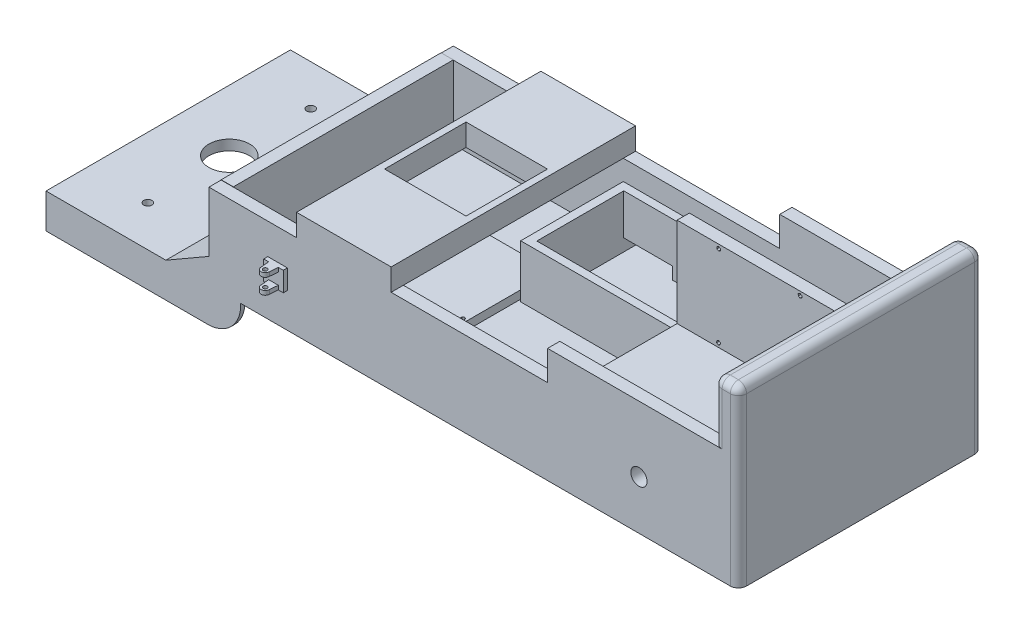
from build123d import *

# Parameters (mm, degrees)
SKETCH1_W            = 650
SKETCH1_H            = 300
BOSS_EXTRUDE1_DEPTH  = 14.434231023
SKETCH2_W            = 30
SKETCH2_H            = 300
BOSS_EXTRUDE2_DEPTH  = 200
SKETCH3_W            = 204.257885315
SKETCH3_H            = 126.141731803
BOSS_EXTRUDE3_DEPTH  = 15
SKETCH4_W            = 204.257885315
SKETCH4_H            = 126.141731803
BOSS_EXTRUDE4_DEPTH  = 15
SKETCH5_R            = 10
CUT_EXTRUDE1_DEPTH   = 330
SKETCH7_W            = 415.742114685
SKETCH7_H            = 89.704743667
BOSS_EXTRUDE5_DEPTH  = 15
SKETCH8_W            = 415.742114685
SKETCH8_H            = 89.704743667
BOSS_EXTRUDE7_DEPTH  = 15
SKETCH9_R            = 10
CUT_EXTRUDE2_DEPTH   = 484
SKETCH14_W           = 204.257885315
SKETCH14_H           = 15
BOSS_EXTRUDE8_DEPTH  = 144
SKETCH19_W           = 204.257885315
SKETCH19_H           = 15
BOSS_EXTRUDE11_DEPTH = 15
SKETCH22_W           = 204.257885315
SKETCH22_H           = 15
BOSS_EXTRUDE13_DEPTH = 110
CUT_EXTRUDE6_DEPTH   = 23
SKETCH24_W           = 300
SKETCH24_H           = 42.5
BOSS_EXTRUDE14_DEPTH = 200
BOSS_EXTRUDE16_DEPTH = 300
SKETCH25_W           = 290
SKETCH25_H           = 29.941232447
CUT_EXTRUDE9_DEPTH   = 287
BOSS_EXTRUDE17_DEPTH = 5
BOSS_EXTRUDE18_START = -5
BOSS_EXTRUDE18_DEPTH = 5
SKETCH17_W           = 147.149375164
SKETCH17_H           = 19.732989455
CUT_EXTRUDE10_DEPTH  = 40
SKETCH40_W           = 204.257885315
SKETCH40_H           = 12.033278305
BOSS_EXTRUDE19_DEPTH = 116
SKETCH42_W           = 120
SKETCH42_H           = 95
BOSS_EXTRUDE21_DEPTH = 8
SKETCH45_W           = 113
SKETCH45_H           = 89
CUT_EXTRUDE14_DEPTH  = 6
SKETCH46_W           = 110
SKETCH46_H           = 110
BOSS_EXTRUDE22_DEPTH = 10
CUT_EXTRUDE18_DEPTH  = 14.5
SKETCH39_R           = 25
SKETCH39_R_2         = 5
CUT_EXTRUDE19_DEPTH  = 42
SKETCH50_W           = 15
SKETCH50_H           = 270
BOSS_EXTRUDE30_DEPTH = 90
SKETCH51_W           = 116.188567321
SKETCH51_H           = 300
BOSS_EXTRUDE33_DEPTH = 27
SKETCH56_W           = 100
SKETCH56_H           = 100
CUT_EXTRUDE22_DEPTH  = 46
SKETCH58_W           = 24
SKETCH58_H           = 24
BOSS_EXTRUDE35_DEPTH = 5
SKETCH61_W           = 24
SKETCH61_H           = 24
BOSS_EXTRUDE36_DEPTH = 5
BOSS_EXTRUDE37_DEPTH = 5
BOSS_EXTRUDE38_START = -5
BOSS_EXTRUDE38_DEPTH = 5
SKETCH64_R           = 2.55
CUT_EXTRUDE23_DEPTH  = 93
BOSS_EXTRUDE39_DEPTH = 5
BOSS_EXTRUDE41_START = -5
BOSS_EXTRUDE41_DEPTH = 5
SKETCH68_R           = 2.536334828
CUT_EXTRUDE25_DEPTH  = 77
SKETCH69_W           = 192.024478138
SKETCH69_H           = 126
BOSS_EXTRUDE42_DEPTH = 65
SKETCH70_W           = 172.724880691
SKETCH70_H           = 106.7
CUT_EXTRUDE26_DEPTH  = 65
FILLET1_R            = 10
FILLET2_R            = 10
FILLET3_R            = 10
FILLET4_R            = 10
SKETCH72_W           = 60
SKETCH72_H           = 15
CUT_EXTRUDE30_DEPTH  = 29


with BuildPart() as part:
    # Sketch1 → Boss-Extrude1 (new body)
    with BuildSketch(Plane(origin=(0, 0, 0), x_dir=(1, 0, 0), z_dir=(0, 1, 0))):
        with Locations((73.326959847, 18.881453155)):
            Rectangle(SKETCH1_W, SKETCH1_H)
    extrude(amount=BOSS_EXTRUDE1_DEPTH)

    # Sketch2 → Boss-Extrude2 (add)
    with BuildSketch(Plane(origin=(0, 14.434231023, 0), x_dir=(1, 0, 0), z_dir=(0, 1, 0))):
        with Locations((383.326959847, 18.881453155)):
            Rectangle(SKETCH2_W, SKETCH2_H)
    extrude(amount=BOSS_EXTRUDE2_DEPTH)

    # Sketch3 → Boss-Extrude3 (add)
    with BuildSketch(Plane.XY.offset(131.118546845)):
        with Locations((266.198017189, 77.505096925)):
            Rectangle(SKETCH3_W, SKETCH3_H)
    extrude(amount=-BOSS_EXTRUDE3_DEPTH)

    # Sketch4 → Boss-Extrude4 (add)
    with BuildSketch(Plane(origin=(0, 0, -168.881453155), x_dir=(-1, 0, 0), z_dir=(0, 0, -1))):
        with Locations((-266.198017189, 77.505096925)):
            Rectangle(SKETCH4_W, SKETCH4_H)
    extrude(amount=-BOSS_EXTRUDE4_DEPTH)

    # Sketch5 → Cut-Extrude1 (cut)
    with BuildSketch(Plane.XY.offset(131.118546845)):
        with Locations((276.18288418, 59.994162141)):
            Circle(SKETCH5_R)
    extrude(amount=-CUT_EXTRUDE1_DEPTH, mode=Mode.SUBTRACT)

    # Sketch7 → Boss-Extrude5 (add)
    with BuildSketch(Plane.XY.offset(131.118546845)):
        with Locations((-43.801982811, 59.286602857)):
            Rectangle(SKETCH7_W, SKETCH7_H)
    extrude(amount=-BOSS_EXTRUDE5_DEPTH)

    # Sketch8 → Boss-Extrude7 (add)
    with BuildSketch(Plane(origin=(0, 0, -168.881453155), x_dir=(-1, 0, 0), z_dir=(0, 0, -1))):
        with Locations((43.801982811, 59.286602857)):
            Rectangle(SKETCH8_W, SKETCH8_H)
    extrude(amount=-BOSS_EXTRUDE7_DEPTH)

    # Sketch9 → Cut-Extrude2 (cut)
    with BuildSketch(Plane.XY.offset(131.118546845)):
        with Locations((-167.367375243, 54.388471659)):
            Circle(SKETCH9_R)
    extrude(amount=-CUT_EXTRUDE2_DEPTH, mode=Mode.SUBTRACT)

    # Sketch14 → Boss-Extrude8 (add)
    with BuildSketch(Plane(origin=(0, -16.725435768, 116.118546845), x_dir=(-1, 0, 0), z_dir=(0, 0, -1))):
        with Locations((-266.198017189, 96.63897469)):
            Rectangle(SKETCH14_W, SKETCH14_H)
    extrude(amount=BOSS_EXTRUDE8_DEPTH)

    # Sketch19 → Boss-Extrude11 (add)
    with BuildSketch(Plane(origin=(0, -16.725435768, -27.881453155), x_dir=(-1, 0, 0), z_dir=(0, 0, -1))):
        with Locations((-266.198017189, 96.63897469)):
            Rectangle(SKETCH19_W, SKETCH19_H)
    extrude(amount=BOSS_EXTRUDE11_DEPTH)

    # Sketch22 → Boss-Extrude13 (add)
    with BuildSketch(Plane(origin=(0, 87.413538922, 0), x_dir=(1, 0, 0), z_dir=(0, 1, 0))):
        with Locations((266.198017189, 35.381453155)):
            Rectangle(SKETCH22_W, SKETCH22_H)
    extrude(amount=BOSS_EXTRUDE13_DEPTH)

    # Sketch23 → Cut-Extrude6 (cut)
    with BuildSketch(Plane.XY.offset(-27.881453155)):
        Polygon((214.986476588, 189.905262908), (217.138557757, 191.177484052), (217.112822512, 193.677351588), (214.935006098, 194.90499798), (212.782924928, 193.632776836), (212.808660173, 191.1329093), align=None)
        Polygon((317.122172265, 191.203050825), (317.107412003, 193.703007252), (314.935006098, 194.940202703), (312.777360455, 193.677441727), (312.792120718, 191.177485301), (314.964526622, 189.94028985), align=None)
        Polygon((317.069819809, 91.203007252), (317.023191734, 93.702572378), (314.835190798, 94.911973844), (312.693817937, 93.621810182), (312.740446013, 91.122245055), (314.928446949, 89.91284359), align=None)
        Polygon((217.00128457, 91.087693837), (217.08976725, 93.586127509), (214.97030156, 94.911972594), (212.76235319, 93.739384007), (212.67387051, 91.240950335), (214.793336199, 89.91510525), align=None)
    extrude(amount=-CUT_EXTRUDE6_DEPTH, mode=Mode.SUBTRACT)



with BuildPart() as body_2:
    # Sketch24 → Boss-Extrude14 (new body)
    with BuildSketch(Plane.ZY.offset(251.673040153)):
        with Locations((-18.881453155, -21.25)):
            Rectangle(SKETCH24_W, SKETCH24_H)
    extrude(amount=BOSS_EXTRUDE14_DEPTH)


with BuildPart() as part_1:
    add(part.part)

    add(body_2.part)  # Boss-Extrude16 merges body 2
    # Sketch28 → Boss-Extrude16 (add)
    with BuildSketch(Plane.XY.offset(131.118546845)):
        Polygon((-251.673040153, 30.477151949), (-304.558589512, 0), (-251.673040153, 0), align=None)
    extrude(amount=-BOSS_EXTRUDE16_DEPTH)

    # Sketch25 → Cut-Extrude9 (cut)
    with BuildSketch(Plane.ZY.offset(451.673040153)):
        with Locations((-18.881453155, -27.529383777)):
            Rectangle(SKETCH25_W, SKETCH25_H)
    extrude(amount=-CUT_EXTRUDE9_DEPTH, mode=Mode.SUBTRACT)

    # Sketch34 → Boss-Extrude17 (add)
    with BuildSketch(Plane.XY.offset(131.118546845)):
        with BuildLine():
            Line((-251.673040153, -42.5), (-251.673040153, 0))
            Line((-251.673040153, 0), (-212.614436804, 0))
            ThreePointArc((-212.614436804, 0), (-223.341700278, -29.339301617), (-251.673040153, -42.5))
        make_face()
    extrude(amount=-BOSS_EXTRUDE17_DEPTH)

    # Sketch35 → Boss-Extrude18 (add)
    with BuildSketch(Plane(origin=(0, 0, -168.881453155), x_dir=(-1, 0, 0), z_dir=(0, 0, -1)).offset(BOSS_EXTRUDE18_START)):
        with BuildLine():
            Line((251.673040153, 0), (251.673040153, -42.5))
            ThreePointArc((251.673040153, -42.5), (223.341700278, -29.339301617), (212.614436804, 0))
            Line((212.614436804, 0), (251.673040153, 0))
        make_face()
    extrude(amount=BOSS_EXTRUDE18_DEPTH)

    # Sketch17 → Cut-Extrude10 (cut)
    with BuildSketch(Plane(origin=(0, 87.413538922, 0), x_dir=(1, 0, 0), z_dir=(0, 1, 0))):
        with Locations((263.570080595, -106.252052117)):
            Rectangle(SKETCH17_W, SKETCH17_H)
    extrude(amount=-CUT_EXTRUDE10_DEPTH, mode=Mode.SUBTRACT)

    # Sketch40 → Boss-Extrude19 (add)
    with BuildSketch(Plane(origin=(0, 0, -42.881453155), x_dir=(-1, 0, 0), z_dir=(0, 0, -1))):
        with Locations((-266.198017189, 78.430178075)):
            Rectangle(SKETCH40_W, SKETCH40_H)
    extrude(amount=BOSS_EXTRUDE19_DEPTH)

    # Sketch42 → Boss-Extrude21 (add)
    with BuildSketch(Plane(origin=(0, 84.446817227, 0), x_dir=(1, 0, 0), z_dir=(0, 1, 0))):
        with Locations((257.155246618, 98.881453155)):
            Rectangle(SKETCH42_W, SKETCH42_H)
    extrude(amount=BOSS_EXTRUDE21_DEPTH)

    # Sketch45 → Cut-Extrude14 (cut)
    with BuildSketch(Plane(origin=(0, 92.446817227, 0), x_dir=(1, 0, 0), z_dir=(0, 1, 0))):
        with Locations((257.155246618, 98.981453155)):
            Rectangle(SKETCH45_W, SKETCH45_H)
    extrude(amount=-CUT_EXTRUDE14_DEPTH, mode=Mode.SUBTRACT)

    # Sketch46 → Boss-Extrude22 (add)
    with BuildSketch(Plane(origin=(0, 14.434231023, 0), x_dir=(1, 0, 0), z_dir=(0, 1, 0))):
        with Locations((-85.831261397, 14.771262625)):
            Rectangle(SKETCH46_W, SKETCH46_H)
    extrude(amount=BOSS_EXTRUDE22_DEPTH)

    # Sketch48 → Cut-Extrude18 (cut)
    with BuildSketch(Plane(origin=(0, 24.434231023, 0), x_dir=(1, 0, 0), z_dir=(0, 1, 0))):
        Polygon((-133.66999343, 63.514711481), (-133.662422202, 66.014700017), (-135.823690168, 67.27125116), (-137.992529363, 66.027813768), (-138.000100591, 63.527825233), (-135.838832625, 62.27127409), align=None)
        Polygon((-33.662422202, 66.014700017), (-35.823690168, 67.27125116), (-37.992529363, 66.027813768), (-38.000100591, 63.527825233), (-35.838832625, 62.27127409), (-33.66999343, 63.514711481), align=None)
        Polygon((-33.662422202, -33.985299983), (-35.823690168, -32.72874884), (-37.992529363, -33.972186232), (-38.000100591, -36.472174767), (-35.838832625, -37.72872591), (-33.66999343, -36.485288519), align=None)
        Polygon((-133.662422202, -33.985299983), (-135.823690168, -32.72874884), (-137.992529363, -33.972186232), (-138.000100591, -36.472174767), (-135.838832625, -37.72872591), (-133.66999343, -36.485288519), align=None)
    extrude(amount=-CUT_EXTRUDE18_DEPTH, mode=Mode.SUBTRACT)

    # Sketch39 → Cut-Extrude19 (cut)
    with BuildSketch(Plane(origin=(0, 0, 0), x_dir=(1, 0, 0), z_dir=(0, 1, 0))):
        with Locations(Location((-376.673040153, 18.881453155, 0), (0, 0, 270))):
            Circle(SKETCH39_R)
        with Locations(Location((-376.673040153, 118.881453155, 0), (0, 0, 270))):
            Circle(SKETCH39_R_2)
        with Locations(Location((-376.673040153, -81.118546845, 0), (0, 0, 270))):
            Circle(SKETCH39_R_2)
    extrude(amount=-CUT_EXTRUDE19_DEPTH, mode=Mode.SUBTRACT)

    # Sketch50 → Boss-Extrude30 (add)
    with BuildSketch(Plane(origin=(0, 14.434231023, 0), x_dir=(1, 0, 0), z_dir=(0, 1, 0))):
        with Locations((-244.173040153, 18.881453155)):
            Rectangle(SKETCH50_W, SKETCH50_H)
    extrude(amount=BOSS_EXTRUDE30_DEPTH)

    # Sketch51 → Boss-Extrude33 (add)
    with BuildSketch(Plane(origin=(0, 104.13897469, 0), x_dir=(1, 0, 0), z_dir=(0, 1, 0))):
        with Locations((-86.049687267, 18.881453155)):
            Rectangle(SKETCH51_W, SKETCH51_H)
    extrude(amount=BOSS_EXTRUDE33_DEPTH)

    # Sketch56 → Cut-Extrude22 (cut)
    with BuildSketch(Plane(origin=(0, 131.13897469, 0), x_dir=(1, 0, 0), z_dir=(0, 1, 0))):
        with Locations((-86.043970927, 18.881453155)):
            Rectangle(SKETCH56_W, SKETCH56_H)
    extrude(amount=-CUT_EXTRUDE22_DEPTH, mode=Mode.SUBTRACT)

    # Sketch58 → Boss-Extrude35 (add)
    with BuildSketch(Plane.XY.offset(131.118546845)):
        with Locations((-167.367375243, 54.388471659)):
            Rectangle(SKETCH58_W, SKETCH58_H)
    extrude(amount=BOSS_EXTRUDE35_DEPTH)

    # Sketch61 → Boss-Extrude36 (add)
    with BuildSketch(Plane(origin=(0, 0, -168.881453155), x_dir=(-1, 0, 0), z_dir=(0, 0, -1))):
        with Locations((167.367375243, 54.388471659)):
            Rectangle(SKETCH61_W, SKETCH61_H)
    extrude(amount=BOSS_EXTRUDE36_DEPTH)

    # Sketch62 → Boss-Extrude37 (add)
    with BuildSketch(Plane(origin=(0, 66.388471659, 0), x_dir=(1, 0, 0), z_dir=(0, 1, 0))):
        with BuildLine():
            Line((-174.067375243, 173.881453155), (-172.367375243, 183.938788786))
            ThreePointArc((-172.367375243, 183.938788786), (-167.367375243, 188.938788786), (-162.367375243, 183.938788786))
            Line((-162.367375243, 183.938788786), (-160.667375243, 173.881453155))
            Line((-160.667375243, 173.881453155), (-174.067375243, 173.881453155))
        make_face()
    extrude(amount=-BOSS_EXTRUDE37_DEPTH)

    # Sketch63 → Boss-Extrude38 (add)
    with BuildSketch(Plane.XZ.offset(-42.388471659).offset(BOSS_EXTRUDE38_START)):
        with BuildLine():
            Line((-174.067375243, -173.881453155), (-172.367375243, -183.938788786))
            ThreePointArc((-172.367375243, -183.938788786), (-167.367375243, -188.938788786), (-162.367375243, -183.938788786))
            Line((-162.367375243, -183.938788786), (-160.667375243, -173.881453155))
            Line((-160.667375243, -173.881453155), (-174.067375243, -173.881453155))
        make_face()
    extrude(amount=BOSS_EXTRUDE38_DEPTH)

    # Sketch64 → Cut-Extrude23 (cut)
    with BuildSketch(Plane(origin=(0, 0, 0), x_dir=(1, 0, 0), z_dir=(0, 1, 0))):
        with Locations(Location((-167.367375243, 183.938788786, 0), (0, 0, 90))):
            Circle(SKETCH64_R)
    extrude(amount=CUT_EXTRUDE23_DEPTH, mode=Mode.SUBTRACT)

    # Sketch65 → Boss-Extrude39 (add)
    with BuildSketch(Plane(origin=(0, 66.388471659, 0), x_dir=(1, 0, 0), z_dir=(0, 1, 0))):
        with BuildLine():
            Line((-173.317375243, -136.118546845), (-172.392375243, -146.276517853))
            ThreePointArc((-172.392375243, -146.276517853), (-167.392375243, -151.276517853), (-162.392375243, -146.276517853))
            Line((-162.392375243, -146.276517853), (-161.467375243, -136.118546845))
            Line((-161.467375243, -136.118546845), (-173.317375243, -136.118546845))
        make_face()
    extrude(amount=-BOSS_EXTRUDE39_DEPTH)

    # Sketch67 → Boss-Extrude41 (add)
    with BuildSketch(Plane.XZ.offset(-42.388471659).offset(BOSS_EXTRUDE41_START)):
        with BuildLine():
            Line((-173.317375243, 136.118546845), (-172.392375243, 146.276517853))
            ThreePointArc((-172.392375243, 146.276517853), (-167.392375243, 151.276517853), (-162.392375243, 146.276517853))
            Line((-162.392375243, 146.276517853), (-161.467375243, 136.118546845))
            Line((-161.467375243, 136.118546845), (-173.317375243, 136.118546845))
        make_face()
    extrude(amount=BOSS_EXTRUDE41_DEPTH)

    # Sketch68 → Cut-Extrude25 (cut)
    with BuildSketch(Plane(origin=(0, 0, 0), x_dir=(1, 0, 0), z_dir=(0, 1, 0))):
        with Locations(Location((-167.392375243, -146.276517853, 0), (0, 0, 270))):
            Circle(SKETCH68_R)
    extrude(amount=CUT_EXTRUDE25_DEPTH, mode=Mode.SUBTRACT)

    # Sketch69 → Boss-Extrude42 (add)
    with BuildSketch(Plane(origin=(0, 14.434231023, 0), x_dir=(1, 0, 0), z_dir=(0, 1, 0))):
        with Locations((68.056835463, 90.881453155)):
            Rectangle(SKETCH69_W, SKETCH69_H)
    extrude(amount=BOSS_EXTRUDE42_DEPTH)

    # Sketch70 → Cut-Extrude26 (cut)
    with BuildSketch(Plane(origin=(0, 79.434231023, 0), x_dir=(1, 0, 0), z_dir=(0, 1, 0))):
        with Locations((68.579416417, 90.881453155)):
            Rectangle(SKETCH70_W, SKETCH70_H)
    extrude(amount=-CUT_EXTRUDE26_DEPTH, mode=Mode.SUBTRACT)

    # Fillet1
    fillet1_edges = [part_1.edges().sort_by_distance(p)[0] for p in [
        (398.326959847, 214.434231023, -18.881453155),
    ]]
    fillet(fillet1_edges, radius=FILLET1_R)

    # Fillet2
    fillet2_edges = [part_1.edges().sort_by_distance(p)[0] for p in [
        (378.326959847, 214.434231023, -168.881453155),
        (398.326959847, 102.217115512, -168.881453155),
        (395.398027659, 211.505298835, -168.881453155),
    ]]
    fillet(fillet2_edges, radius=FILLET2_R)

    # Fillet3
    fillet3_edges = [part_1.edges().sort_by_distance(p)[0] for p in [
        (378.326959847, 214.434231023, 131.118546845),
        (398.326959847, 102.217115512, 131.118546845),
        (395.398027659, 211.505298835, 131.118546845),
    ]]
    fillet(fillet3_edges, radius=FILLET3_R)

    # Fillet4
    fillet4_edges = [part_1.edges().sort_by_distance(p)[0] for p in [
        (368.326959847, 172.505096925, -168.881453155),
        (368.326959847, 214.434231023, -18.881453155),
        (368.326959847, 211.505298835, -165.952520967),
        (368.326959847, 172.505096925, 131.118546845),
        (368.326959847, 211.505298835, 128.189614657),
    ]]
    fillet(fillet4_edges, radius=FILLET4_R)

    # Sketch72 → Cut-Extrude30 (cut)
    with BuildSketch(Plane.XY.offset(-144.231453155)):
        with Locations((12.216976072, 21.934231023)):
            Rectangle(SKETCH72_W, SKETCH72_H)
    extrude(amount=-CUT_EXTRUDE30_DEPTH, mode=Mode.SUBTRACT)


solid = part_1.part
